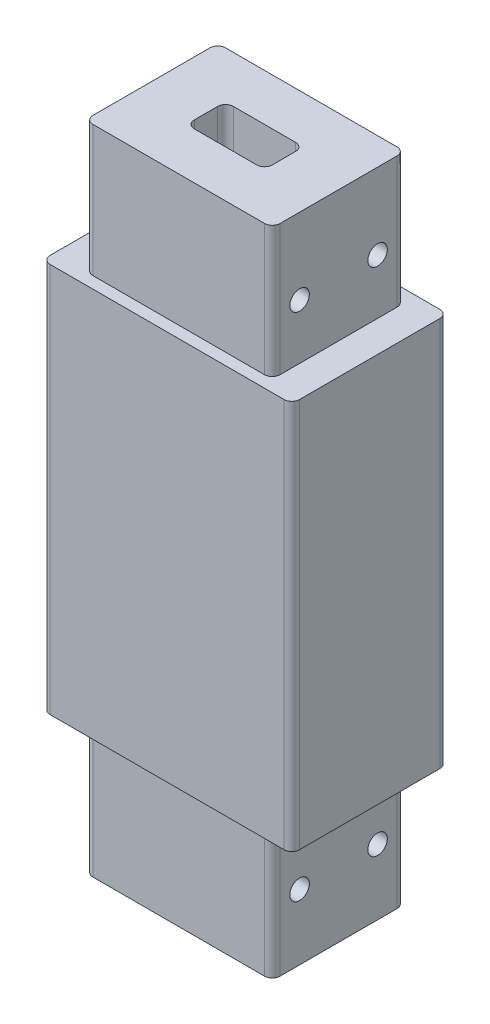
from build123d import *

# Parameters (mm, degrees)
SKETCH1_W                = 32
SKETCH1_H                = 20
BOSS_EXTRUDE1_DEPTH      = 50
BOSS_EXTRUDE2_DEPTH      = 41.8
CUT_EXTRUDE1_DEPTH       = 16.8
CUT_EXTRUDE2_START       = -16.8
CUT_EXTRUDE2_DEPTH       = 16.8
SKETCH5_R                = 0.5
CUT_EXTRUDE3_DEPTH       = 70.413543347
M2_5X0_45_TAPPED_HOLE1_D = 2.5
M2_5X0_45_TAPPED_HOLE2_D = 2.5
FILLET1_R                = 1
M2_5X0_45_TAPPED_HOLE4_D = 2.5


with BuildPart() as part:
    # Sketch1 → Boss-Extrude1 (new body)
    with BuildSketch(Plane(origin=(0, 0, 0), x_dir=(1, 0, 0), z_dir=(0, 1, 0))):
        Rectangle(SKETCH1_W, SKETCH1_H)
    extrude(amount=BOSS_EXTRUDE1_DEPTH)

    # Sketch2 → Boss-Extrude2 (add, symmetric)
    with BuildSketch(Plane(origin=(0, 25, 0), x_dir=(1, 0, 0), z_dir=(0, 1, 0))):
        with BuildLine():
            Line((-11, -8.5), (11, -8.5))
            ThreePointArc((11, -8.5), (11.707106781, -8.207106781), (12, -7.5))
            Line((12, -7.5), (12, 7.5))
            ThreePointArc((12, 7.5), (11.707106781, 8.207106781), (11, 8.5))
            Line((11, 8.5), (-11, 8.5))
            ThreePointArc((-11, 8.5), (-11.707106781, 8.207106781), (-12, 7.5))
            Line((-12, 7.5), (-12, -7.5))
            ThreePointArc((-12, -7.5), (-11.707106781, -8.207106781), (-11, -8.5))
        make_face()
    extrude(amount=BOSS_EXTRUDE2_DEPTH, both=True)

    # Sketch3 → Cut-Extrude1 (cut)
    with BuildSketch(Plane(origin=(0, 66.8, 0), x_dir=(1, 0, 0), z_dir=(0, 1, 0))):
        with BuildLine():
            Line((-4, -2.5), (4, -2.5))
            ThreePointArc((4, -2.5), (4.707106781, -2.207106781), (5, -1.5))
            Line((5, -1.5), (5, 1.5))
            ThreePointArc((5, 1.5), (4.707106781, 2.207106781), (4, 2.5))
            Line((4, 2.5), (-4, 2.5))
            ThreePointArc((-4, 2.5), (-4.707106781, 2.207106781), (-5, 1.5))
            Line((-5, 1.5), (-5, -1.5))
            ThreePointArc((-5, -1.5), (-4.707106781, -2.207106781), (-4, -2.5))
        make_face()
    extrude(amount=-CUT_EXTRUDE1_DEPTH, mode=Mode.SUBTRACT)

    # Sketch4 → Cut-Extrude2 (cut)
    with BuildSketch(Plane.XZ.offset(16.8).offset(CUT_EXTRUDE2_START)):
        with BuildLine():
            Line((-4, -2.5), (4, -2.5))
            ThreePointArc((4, -2.5), (4.707106781, -2.207106781), (5, -1.5))
            Line((5, -1.5), (5, 1.5))
            ThreePointArc((5, 1.5), (4.707106781, 2.207106781), (4, 2.5))
            Line((4, 2.5), (-4, 2.5))
            ThreePointArc((-4, 2.5), (-4.707106781, 2.207106781), (-5, 1.5))
            Line((-5, 1.5), (-5, -1.5))
            ThreePointArc((-5, -1.5), (-4.707106781, -2.207106781), (-4, -2.5))
        make_face()
    extrude(amount=CUT_EXTRUDE2_DEPTH, mode=Mode.SUBTRACT)

    # Sketch5 → Cut-Extrude3 (cut, through all)
    with BuildSketch(Plane(origin=(0, 50, 0), x_dir=(1, 0, 0), z_dir=(0, 1, 0))):
        with Locations(Location((0, 0, 0), (0, 0, 270))):
            Circle(SKETCH5_R)
    extrude(amount=-CUT_EXTRUDE3_DEPTH, mode=Mode.SUBTRACT)

    # M2.5x0.45 Tapped Hole1 (through all)
    with Locations(Plane.ZY.offset(12)):
        with Locations((5, -8.4)):
            Hole(M2_5X0_45_TAPPED_HOLE1_D / 2)

    # M2.5x0.45 Tapped Hole2 (through all)
    with Locations(Plane(origin=(12, 0, 0), x_dir=(0, 0, -1), z_dir=(1, 0, 0))):
        with Locations((5, -8.4)):
            Hole(M2_5X0_45_TAPPED_HOLE2_D / 2)

    # Fillet1
    fillet1_edges = [part.edges().sort_by_distance(p)[0] for p in [
        (16, 25, 10),
        (-16, 25, 10),
        (-16, 25, -10),
        (16, 25, -10),
    ]]
    fillet(fillet1_edges, radius=FILLET1_R)

    # M2.5x0.45 Tapped Hole4 (through all)
    with Locations(Plane.ZY.offset(12)):
        with Locations((-5, 57.05), (5, 57.05)):
            Hole(M2_5X0_45_TAPPED_HOLE4_D / 2)


solid = part.part
